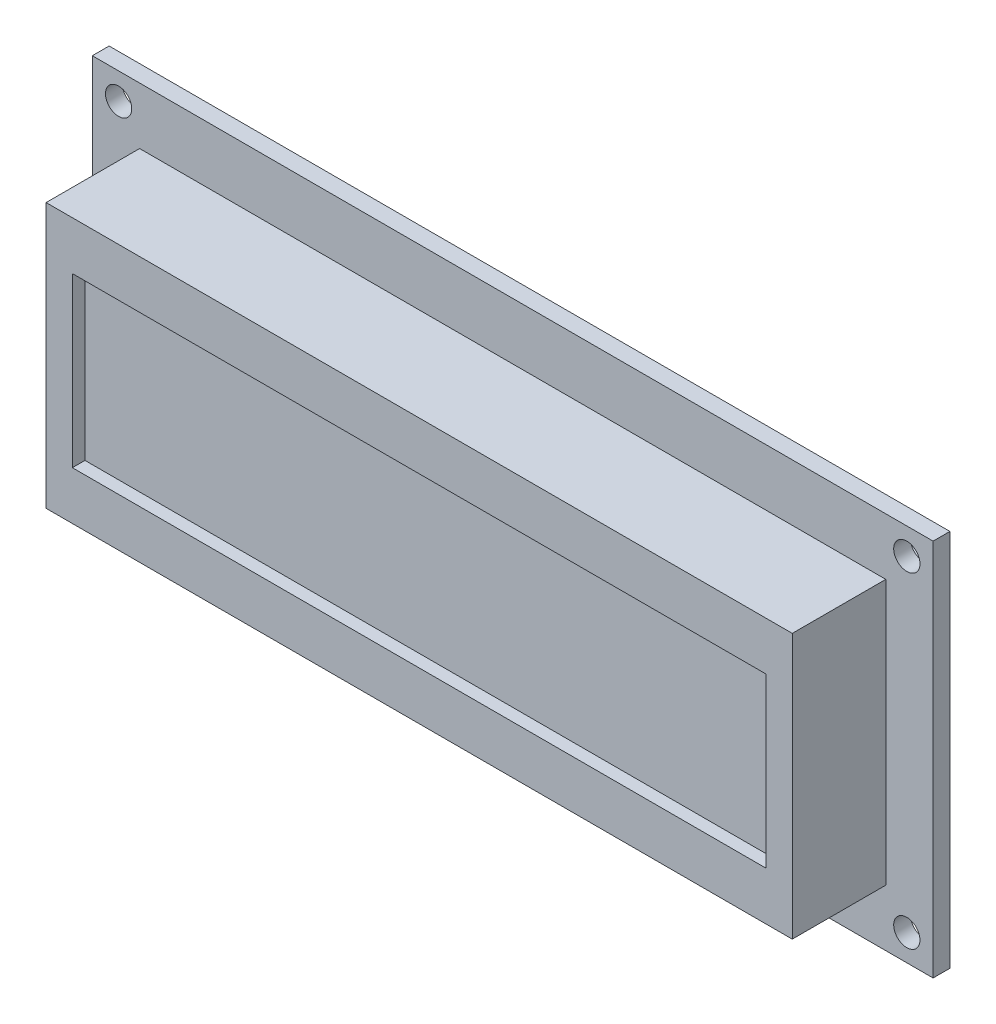
from build123d import *

# Parameters (mm, degrees)
SKETCH2_W           = 80
SKETCH2_H           = 36
SKETCH2_W_2         = 71
SKETCH2_H_2         = 25.2
SKETCH2_W_3         = 66
SKETCH2_H_3         = 16
BOSS_EXTRUDE1_DEPTH = 1.6
BOSS_EXTRUDE2_START = 8.9
SKETCH2_3_W         = 71
SKETCH2_3_H         = 25.2
SKETCH2_3_W_2       = 66
SKETCH2_3_H_2       = 16
BOSS_EXTRUDE2_DEPTH = 13.5
CUT_EXTRUDE1_START  = 8.9
SKETCH2_4_W         = 66
SKETCH2_4_H         = 16
CUT_EXTRUDE1_DEPTH  = 1.2
SKETCH3_R           = 1.25
CUT_EXTRUDE2_DEPTH  = 45.757234052


with BuildPart() as part:
    # Sketch2 → Boss-Extrude1 (new body)
    # profile 1 of 3: a face of its own
    with BuildSketch(Plane.XY):
        Rectangle(SKETCH2_W, SKETCH2_H)
        Rectangle(SKETCH2_W_2, SKETCH2_H_2, mode=Mode.SUBTRACT)
    # profile 2 of 3: a face of its own
    with BuildSketch(Plane.XY):
        Rectangle(SKETCH2_W_2, SKETCH2_H_2)
        Rectangle(SKETCH2_W_3, SKETCH2_H_3, mode=Mode.SUBTRACT)
    # profile 3 of 3: a face of its own
    with BuildSketch(Plane.XY):
        Rectangle(SKETCH2_W_3, SKETCH2_H_3)
    extrude(amount=-BOSS_EXTRUDE1_DEPTH)

    # Sketch2<3> → Boss-Extrude2 (add)
    # profile 1 of 2: a face of its own
    with BuildSketch(Plane.XY.offset(BOSS_EXTRUDE2_START)):
        Rectangle(SKETCH2_3_W, SKETCH2_3_H)
        Rectangle(SKETCH2_3_W_2, SKETCH2_3_H_2, mode=Mode.SUBTRACT)
    # profile 2 of 2: a face of its own
    with BuildSketch(Plane.XY.offset(BOSS_EXTRUDE2_START)):
        Rectangle(SKETCH2_3_W_2, SKETCH2_3_H_2)
    extrude(amount=-BOSS_EXTRUDE2_DEPTH)

    # Sketch2<4> → Cut-Extrude1 (cut)
    with BuildSketch(Plane.XY.offset(CUT_EXTRUDE1_START)):
        Rectangle(SKETCH2_4_W, SKETCH2_4_H)
    extrude(amount=-CUT_EXTRUDE1_DEPTH, mode=Mode.SUBTRACT)

    # Sketch3 → Cut-Extrude2 (cut, through all)
    with BuildSketch(Plane.XY):
        with Locations((37.5, 15.5)):
            Circle(SKETCH3_R)
        with Locations((-37.5, 15.5)):
            Circle(SKETCH3_R)
        with Locations((37.5, -15.5)):
            Circle(SKETCH3_R)
        with Locations((-37.5, -15.5)):
            Circle(SKETCH3_R)
    extrude(amount=-CUT_EXTRUDE2_DEPTH, mode=Mode.SUBTRACT)


solid = part.part
